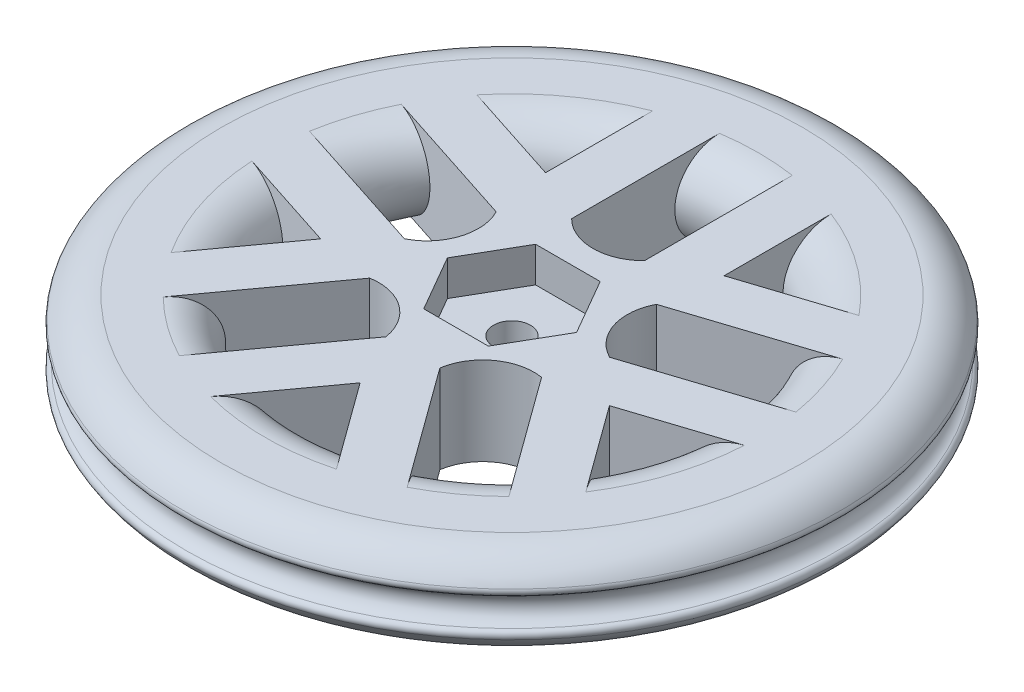
from build123d import *

# Parameters (mm, degrees)
SKETCH_1_W          = 9
SKETCH_1_H          = 10
CUT_EXTRUDE_1_DEPTH = 4
EXTRUDE_1_DEPTH     = 10
CUT_EXTRUDE_2_DEPTH = 2.5
CUT_EXTRUDE_3_DEPTH = 4
SKETCH_8_R          = 2.1
CUT_EXTRUDE_4_DEPTH = 55.07402349
SKETCH_9_R          = 1.7
FILLET_1_R          = 0.6


with BuildPart() as part:
    # 草图1 → 旋转1 (revolve)
    with BuildSketch(Plane(origin=(0, 0, 0), x_dir=(0, 0, -1), z_dir=(1, 0, 0))):
        with Locations((4.5, -5)):
            Rectangle(SKETCH_1_W, SKETCH_1_H)
    revolve(axis=Axis((0, 0, 0), (0, 1, 0)))

    # 草图2 → 切除-拉伸1 (cut)
    with BuildSketch(Plane(origin=(0, 0, 0), x_dir=(1, 0, 0), z_dir=(0, 1, 0))):
        Polygon((7.273277686, -0.139397656), (3.757360754, 6.229144417), (-3.515916932, 6.368542072), (-7.273277686, 0.139397656), (-3.757360754, -6.229144417), (3.515916932, -6.368542072), align=None)
    extrude(amount=-CUT_EXTRUDE_1_DEPTH, mode=Mode.SUBTRACT)



with BuildPart() as body_2:
    # 草图4 → 旋转2 (revolve)
    with BuildSketch(Plane.XY, mode=Mode.PRIVATE) as revolve_2_sk:
        with BuildLine():
            Line((28, 0), (33, 0))
            ThreePointArc((33, 0), (38, -5), (33, -10))
            Line((33, -10), (28, -10))
            ThreePointArc((28, -10), (23, -5), (28, 0))
        make_face()
    revolve(revolve_2_sk.sketch.rotate(Axis((0, 0, 0), (0, 1, 0)), 90), axis=Axis((0, 0, 0), (0, 1, 0)))


with BuildPart() as part_1:
    add(part.part)

    add(body_2.part)  # 凸台-拉伸1 merges body 2
    # 草图5 → 凸台-拉伸1 (add)
    with BuildSketch(Plane(origin=(0, 0, 0), x_dir=(1, 0, 0), z_dir=(0, 1, 0))):
        with BuildLine():
            Line((4.132923872, 27.076214599), (4.132923872, 10.906852593))
            ThreePointArc((4.132923872, 10.906852593), (0, 9.183221216), (-4.132923872, 10.906852593))
            Line((-4.132923872, 10.906852593), (-4.132923872, 27.076214599))
            Line((-4.132923872, 27.076214599), (-4.132923872, 27.693301361))
            ThreePointArc((-4.132923872, 27.693301361), (-7.177152566, 27.064524401), (-10.132923872, 26.102181016))
            Line((-10.132923872, 26.102181016), (-10.132923872, 13.946773219))
            Line((-10.132923872, 13.946773219), (-5.352670057, 12.393574602))
            ThreePointArc((-5.352670057, 12.393574602), (-3.005110461, 8.217440935), (-2.508406985, 3.452526024))
            ThreePointArc((-2.508406985, 3.452526024), (0, 3.183221216), (2.508406985, 3.452526024))
            ThreePointArc((2.508406985, 3.452526024), (3.005110461, 8.217440935), (5.352670057, 12.393574602))
            Line((5.352670057, 12.393574602), (10.132923872, 13.946773219))
            Line((10.132923872, 13.946773219), (10.132923872, 26.102181016))
            ThreePointArc((10.132923872, 26.102181016), (7.177152566, 27.064524401), (4.132923872, 27.693301361))
            Line((4.132923872, 27.693301361), (4.132923872, 27.076214599))
        make_face()
        with BuildLine():
            Line((10.132923872, 8.92051691), (10.132923872, 13.946773219))
            Line((10.132923872, 13.946773219), (5.352670057, 12.393574602))
            ThreePointArc((5.352670057, 12.393574602), (3.005110461, 8.217440935), (2.508406985, 3.452526024))
            ThreePointArc((2.508406985, 3.452526024), (6.886620546, 5.397358786), (10.132923872, 8.92051691))
        make_face()
        with BuildLine():
            Line((21.693403666, 17.703000802), (10.132923872, 13.946773219))
            Line((10.132923872, 13.946773219), (10.132923872, 8.92051691))
            ThreePointArc((10.132923872, 8.92051691), (6.886620546, 5.397358786), (2.508406985, 3.452526024))
            ThreePointArc((2.508406985, 3.452526024), (3.02742328, 0.983669452), (4.05868776, -1.318747594))
            ThreePointArc((4.05868776, -1.318747594), (8.743880951, -0.318700987), (13.441055898, -1.260866564))
            Line((13.441055898, -1.260866564), (16.395415231, -5.327193336))
            Line((16.395415231, -5.327193336), (27.955895024, -1.570965754))
            ThreePointArc((27.955895024, -1.570965754), (27.988971584, -0.785792378), (28, 0))
            ThreePointArc((28, 0), (27.90359364, 2.32152148), (27.61503843, 4.627056571))
            Line((27.61503843, 4.627056571), (27.028154044, 4.436366275))
            Line((27.028154044, 4.436366275), (11.650176944, -0.560241374))
            ThreePointArc((11.650176944, -0.560241374), (8.733762378, 2.837771419), (9.095889518, 7.301046986))
            Line((9.095889518, 7.301046986), (24.473866618, 12.297654635))
            Line((24.473866618, 12.297654635), (25.060751004, 12.488344931))
            ThreePointArc((25.060751004, 12.488344931), (23.522030178, 15.189275701), (21.693403666, 17.703000802))
        make_face()
        with BuildLine():
            ThreePointArc((13.441055898, -1.260866564), (8.743880951, -0.318700987), (4.05868776, -1.318747594))
            ThreePointArc((4.05868776, -1.318747594), (7.261276026, -4.881689756), (11.615161415, -6.880391954))
            Line((11.615161415, -6.880391954), (16.395415231, -5.327193336))
            Line((16.395415231, -5.327193336), (13.441055898, -1.260866564))
        make_face()
        with BuildLine():
            Line((28.930267077, 5.054400263), (27.61503843, 4.627056571))
            ThreePointArc((27.61503843, 4.627056571), (27.90359364, 2.32152148), (28, 0))
            ThreePointArc((28, 0), (27.988971584, -0.785792378), (27.955895024, -1.570965754))
            Line((27.955895024, -1.570965754), (28.882256011, -1.269972823))
            Line((28.882256011, -1.269972823), (30.784369043, -0.651938834))
            Line((30.784369043, -0.651938834), (28.930267077, 5.054400263))
        make_face()
        with BuildLine():
            Line((22.619764652, 18.003993732), (21.693403666, 17.703000802))
            ThreePointArc((21.693403666, 17.703000802), (23.522030178, 15.189275701), (25.060751004, 12.488344931))
            Line((25.060751004, 12.488344931), (26.375979651, 12.915688623))
            Line((26.375979651, 12.915688623), (24.521877685, 18.622027721))
            Line((24.521877685, 18.622027721), (22.619764652, 18.003993732))
        make_face()
        with BuildLine():
            Line((4.132923872, 29.076214599), (4.132923872, 27.693301361))
            ThreePointArc((4.132923872, 27.693301361), (7.177152566, 27.064524401), (10.132923872, 26.102181016))
            Line((10.132923872, 26.102181016), (10.132923872, 27.076214599))
            Line((10.132923872, 27.076214599), (10.132923872, 29.076214599))
            Line((10.132923872, 29.076214599), (4.132923872, 29.076214599))
        make_face()
        with BuildLine():
            ThreePointArc((-10.132923872, 26.102181016), (-7.177152566, 27.064524401), (-4.132923872, 27.693301361))
            Line((-4.132923872, 27.693301361), (-4.132923872, 29.076214599))
            Line((-4.132923872, 29.076214599), (-10.132923872, 29.076214599))
            Line((-10.132923872, 29.076214599), (-10.132923872, 27.076214599))
            Line((-10.132923872, 27.076214599), (-10.132923872, 26.102181016))
        make_face()
        with BuildLine():
            Line((-5.352670057, 12.393574602), (-10.132923872, 13.946773219))
            Line((-10.132923872, 13.946773219), (-10.132923872, 8.92051691))
            ThreePointArc((-10.132923872, 8.92051691), (-6.886620546, 5.397358786), (-2.508406985, 3.452526024))
            ThreePointArc((-2.508406985, 3.452526024), (-3.005110461, 8.217440935), (-5.352670057, 12.393574602))
        make_face()
        with BuildLine():
            Line((-10.132923872, 8.92051691), (-10.132923872, 13.946773219))
            Line((-10.132923872, 13.946773219), (-21.693403666, 17.703000802))
            ThreePointArc((-21.693403666, 17.703000802), (-23.522030178, 15.189275701), (-25.060751004, 12.488344931))
            Line((-25.060751004, 12.488344931), (-24.473866618, 12.297654635))
            Line((-24.473866618, 12.297654635), (-9.095889518, 7.301046986))
            ThreePointArc((-9.095889518, 7.301046986), (-8.733762378, 2.837771419), (-11.650176944, -0.560241374))
            Line((-11.650176944, -0.560241374), (-27.028154044, 4.436366275))
            Line((-27.028154044, 4.436366275), (-27.61503843, 4.627056571))
            ThreePointArc((-27.61503843, 4.627056571), (-27.957754406, 1.537520268), (-27.955895024, -1.570965754))
            Line((-27.955895024, -1.570965754), (-16.395415231, -5.327193336))
            Line((-16.395415231, -5.327193336), (-13.441055898, -1.260866564))
            ThreePointArc((-13.441055898, -1.260866564), (-8.743880951, -0.318700987), (-4.05868776, -1.318747594))
            ThreePointArc((-4.05868776, -1.318747594), (-3.02742328, 0.983669452), (-2.508406985, 3.452526024))
            ThreePointArc((-2.508406985, 3.452526024), (-6.886620546, 5.397358786), (-10.132923872, 8.92051691))
        make_face()
        with BuildLine():
            ThreePointArc((-25.060751004, 12.488344931), (-23.522030178, 15.189275701), (-21.693403666, 17.703000802))
            Line((-21.693403666, 17.703000802), (-22.619764652, 18.003993732))
            Line((-22.619764652, 18.003993732), (-24.521877685, 18.622027721))
            Line((-24.521877685, 18.622027721), (-26.375979651, 12.915688623))
            Line((-26.375979651, 12.915688623), (-25.060751004, 12.488344931))
        make_face()
        with BuildLine():
            ThreePointArc((-27.955895024, -1.570965754), (-27.957754406, 1.537520268), (-27.61503843, 4.627056571))
            Line((-27.61503843, 4.627056571), (-28.930267077, 5.054400263))
            Line((-28.930267077, 5.054400263), (-30.784369043, -0.651938834))
            Line((-30.784369043, -0.651938834), (-28.882256011, -1.269972823))
            Line((-28.882256011, -1.269972823), (-27.955895024, -1.570965754))
        make_face()
        with BuildLine():
            ThreePointArc((-11.615161415, -6.880391954), (-7.261276026, -4.881689756), (-4.05868776, -1.318747594))
            ThreePointArc((-4.05868776, -1.318747594), (-8.743880951, -0.318700987), (-13.441055898, -1.260866564))
            Line((-13.441055898, -1.260866564), (-16.395415231, -5.327193336))
            Line((-16.395415231, -5.327193336), (-11.615161415, -6.880391954))
        make_face()
        with BuildLine():
            ThreePointArc((0, -4.267556859), (-1.871050485, -2.57528006), (-4.05868776, -1.318747594))
            ThreePointArc((-4.05868776, -1.318747594), (-7.261276026, -4.881689756), (-11.615161415, -6.880391954))
            Line((-11.615161415, -6.880391954), (-16.395415231, -5.327193336))
            Line((-16.395415231, -5.327193336), (-23.540184669, -15.161124818))
            ThreePointArc((-23.540184669, -15.161124818), (-21.7145667, -17.677035753), (-19.621319776, -19.97507973))
            Line((-19.621319776, -19.97507973), (-19.258605279, -19.475846053))
            Line((-19.258605279, -19.475846053), (-9.754492752, -6.394557402))
            ThreePointArc((-9.754492752, -6.394557402), (-5.397761999, -7.429382027), (-3.067281454, -11.253100804))
            Line((-3.067281454, -11.253100804), (-12.57139398, -24.334389455))
            Line((-12.57139398, -24.334389455), (-12.934108478, -24.833623132))
            ThreePointArc((-12.934108478, -24.833623132), (-10.101689906, -26.114284617), (-7.144769439, -27.073091247))
            Line((-7.144769439, -27.073091247), (0, -17.239159766))
            Line((0, -17.239159766), (-2.954359333, -13.172832994))
            ThreePointArc((-2.954359333, -13.172832994), (-2.39890516, -8.414408977), (0, -4.267556859))
        make_face()
        with BuildLine():
            ThreePointArc((-19.621319776, -19.97507973), (-21.7145667, -17.677035753), (-23.540184669, -15.161124818))
            Line((-23.540184669, -15.161124818), (-24.112707245, -15.94913454))
            Line((-24.112707245, -15.94913454), (-25.288277749, -17.567168528))
            Line((-25.288277749, -17.567168528), (-20.434175783, -21.093880042))
            Line((-20.434175783, -21.093880042), (-19.621319776, -19.97507973))
        make_face()
        with BuildLine():
            Line((-7.717292014, -27.861100969), (-7.144769439, -27.073091247))
            ThreePointArc((-7.144769439, -27.073091247), (-10.101689906, -26.114284617), (-12.934108478, -24.833623132))
            Line((-12.934108478, -24.833623132), (-13.746964485, -25.952423444))
            Line((-13.746964485, -25.952423444), (-8.892862519, -29.479134958))
            Line((-8.892862519, -29.479134958), (-7.717292014, -27.861100969))
        make_face()
        with BuildLine():
            ThreePointArc((2.954359333, -13.172832994), (2.39890516, -8.414408977), (0, -4.267556859))
            ThreePointArc((0, -4.267556859), (-2.39890516, -8.414408977), (-2.954359333, -13.172832994))
            Line((-2.954359333, -13.172832994), (0, -17.239159766))
            Line((0, -17.239159766), (2.954359333, -13.172832994))
        make_face()
        with BuildLine():
            ThreePointArc((11.615161415, -6.880391954), (7.261276026, -4.881689756), (4.05868776, -1.318747594))
            ThreePointArc((4.05868776, -1.318747594), (1.871050485, -2.57528006), (0, -4.267556859))
            ThreePointArc((0, -4.267556859), (2.39890516, -8.414408977), (2.954359333, -13.172832994))
            Line((2.954359333, -13.172832994), (0, -17.239159766))
            Line((0, -17.239159766), (7.144769439, -27.073091247))
            ThreePointArc((7.144769439, -27.073091247), (10.101689906, -26.114284617), (12.934108478, -24.833623132))
            Line((12.934108478, -24.833623132), (12.57139398, -24.334389455))
            Line((12.57139398, -24.334389455), (3.067281454, -11.253100804))
            ThreePointArc((3.067281454, -11.253100804), (5.397761999, -7.429382027), (9.754492752, -6.394557402))
            Line((9.754492752, -6.394557402), (19.258605279, -19.475846053))
            Line((19.258605279, -19.475846053), (19.621319776, -19.97507973))
            ThreePointArc((19.621319776, -19.97507973), (21.7145667, -17.677035753), (23.540184669, -15.161124818))
            Line((23.540184669, -15.161124818), (16.395415231, -5.327193336))
            Line((16.395415231, -5.327193336), (11.615161415, -6.880391954))
        make_face()
        with BuildLine():
            ThreePointArc((12.934108478, -24.833623132), (10.101689906, -26.114284617), (7.144769439, -27.073091247))
            Line((7.144769439, -27.073091247), (7.717292014, -27.861100969))
            Line((7.717292014, -27.861100969), (8.892862519, -29.479134958))
            Line((8.892862519, -29.479134958), (13.746964485, -25.952423444))
            Line((13.746964485, -25.952423444), (12.934108478, -24.833623132))
        make_face()
        with BuildLine():
            Line((24.112707245, -15.94913454), (23.540184669, -15.161124818))
            ThreePointArc((23.540184669, -15.161124818), (21.7145667, -17.677035753), (19.621319776, -19.97507973))
            Line((19.621319776, -19.97507973), (20.434175783, -21.093880042))
            Line((20.434175783, -21.093880042), (25.288277749, -17.567168528))
            Line((25.288277749, -17.567168528), (24.112707245, -15.94913454))
        make_face()
        with BuildLine():
            ThreePointArc((4.05868776, -1.318747594), (3.02742328, 0.983669452), (2.508406985, 3.452526024))
            ThreePointArc((2.508406985, 3.452526024), (0, 3.183221216), (-2.508406985, 3.452526024))
            ThreePointArc((-2.508406985, 3.452526024), (-3.02742328, 0.983669452), (-4.05868776, -1.318747594))
            ThreePointArc((-4.05868776, -1.318747594), (-1.871050485, -2.57528006), (0, -4.267556859))
            ThreePointArc((0, -4.267556859), (1.871050485, -2.57528006), (4.05868776, -1.318747594))
        make_face()
    extrude(amount=-EXTRUDE_1_DEPTH)

    # 草图6 → 切除-拉伸2 (cut)
    with BuildSketch(Plane.XZ.offset(10)):
        with BuildLine():
            Line((8.332923872, -27.068079091), (8.332923872, -11.469285762))
            Line((8.332923872, -11.469285762), (23.168257914, -16.289577993))
            ThreePointArc((23.168257914, -16.289577993), (23.859270205, -15.259546232), (24.504520414, -14.20024666))
            Line((24.504520414, -14.20024666), (7.889674226, -8.801755884))
            ThreePointArc((7.889674226, -8.801755884), (7.021860648, -2.281540829), (11.556422832, 2.483335935))
            Line((11.556422832, 2.483335935), (28.17126902, -2.915154842))
            ThreePointArc((28.17126902, -2.915154842), (28.271891301, -1.678894929), (28.318288092, -0.439414896))
            Line((28.318288092, -0.439414896), (13.482954051, 4.380877335))
            Line((13.482954051, 4.380877335), (22.651694723, 17.000566229))
            ThreePointArc((22.651694723, 17.000566229), (21.885610847, 17.976055291), (21.077550366, 18.917066276))
            Line((21.077550366, 18.917066276), (10.809010704, 4.783633936))
            ThreePointArc((10.809010704, 4.783633936), (4.339748545, 5.973151437), (1.209338226, 11.758204246))
            Line((1.209338226, 11.758204246), (11.477877888, 25.891636586))
            ThreePointArc((11.477877888, 25.891636586), (10.333218838, 26.369359385), (9.168740672, 26.79650575))
            Line((9.168740672, 26.79650575), (0, 14.176816856))
            Line((0, 14.176816856), (-9.168740672, 26.79650575))
            ThreePointArc((-9.168740672, 26.79650575), (-10.333218838, 26.369359385), (-11.477877888, 25.891636586))
            Line((-11.477877888, 25.891636586), (-1.209338226, 11.758204246))
            ThreePointArc((-1.209338226, 11.758204246), (-4.339748545, 5.973151437), (-10.809010704, 4.783633936))
            Line((-10.809010704, 4.783633936), (-21.077550366, 18.917066276))
            ThreePointArc((-21.077550366, 18.917066276), (-21.885610847, 17.976055291), (-22.651694723, 17.000566229))
            Line((-22.651694723, 17.000566229), (-13.482954051, 4.380877335))
            Line((-13.482954051, 4.380877335), (-28.318288092, -0.439414896))
            ThreePointArc((-28.318288092, -0.439414896), (-28.271891301, -1.678894929), (-28.17126902, -2.915154842))
            Line((-28.17126902, -2.915154842), (-11.556422832, 2.483335935))
            ThreePointArc((-11.556422832, 2.483335935), (-7.021860648, -2.281540829), (-7.889674226, -8.801755884))
            Line((-7.889674226, -8.801755884), (-24.504520414, -14.20024666))
            ThreePointArc((-24.504520414, -14.20024666), (-23.859270205, -15.259546232), (-23.168257914, -16.289577993))
            Line((-23.168257914, -16.289577993), (-8.332923872, -11.469285762))
            Line((-8.332923872, -11.469285762), (-8.332923872, -27.068079091))
            ThreePointArc((-8.332923872, -27.068079091), (-7.139770913, -27.406973515), (-5.932923872, -27.693301361))
            Line((-5.932923872, -27.693301361), (-5.932923872, -10.223418233))
            ThreePointArc((-5.932923872, -10.223418233), (0, -7.383221216), (5.932923872, -10.223418233))
            Line((5.932923872, -10.223418233), (5.932923872, -27.693301361))
            ThreePointArc((5.932923872, -27.693301361), (7.139770913, -27.406973515), (8.332923872, -27.068079091))
        make_face()
    extrude(amount=-CUT_EXTRUDE_2_DEPTH, mode=Mode.SUBTRACT)

    # 草图7 → 切除-拉伸3 (cut)
    with BuildSketch(Plane(origin=(0, 0, 0), x_dir=(1, 0, 0), z_dir=(0, 1, 0))):
        Polygon((7.332348419, 0), (3.666174209, 6.35), (-3.666174209, 6.35), (-7.332348419, 0), (-3.666174209, -6.35), (3.666174209, -6.35), align=None)
    extrude(amount=-CUT_EXTRUDE_3_DEPTH, mode=Mode.SUBTRACT)

    # 草图8 → 切除-拉伸4 (cut, through all)
    with BuildSketch(Plane(origin=(0, -4, 0), x_dir=(1, 0, 0), z_dir=(0, 1, 0))):
        with Locations(Location((0, 0, 0), (0, 0, 270))):
            Circle(SKETCH_8_R)
    extrude(amount=-CUT_EXTRUDE_4_DEPTH, mode=Mode.SUBTRACT)

    # 草图9 → 切除-旋转1 (revolve, cut)
    with BuildSketch(Plane.XY, mode=Mode.PRIVATE) as cut_revolve_1_sk:
        with Locations((37.5, -5)):
            Circle(SKETCH_9_R)
    revolve(cut_revolve_1_sk.sketch.rotate(Axis((0, 0, 0), (0, 1, 0)), 90), axis=Axis((0, 0, 0), (0, 1, 0)), mode=Mode.SUBTRACT)

    # 圆角1
    fillet_1_edges = [part_1.edges().sort_by_distance(p)[0] for p in [
        (0, -3.312608851, 37.706666667),
        (0, -6.687391149, 37.706666667),
    ]]
    fillet(fillet_1_edges, radius=FILLET_1_R)


solid = part_1.part
